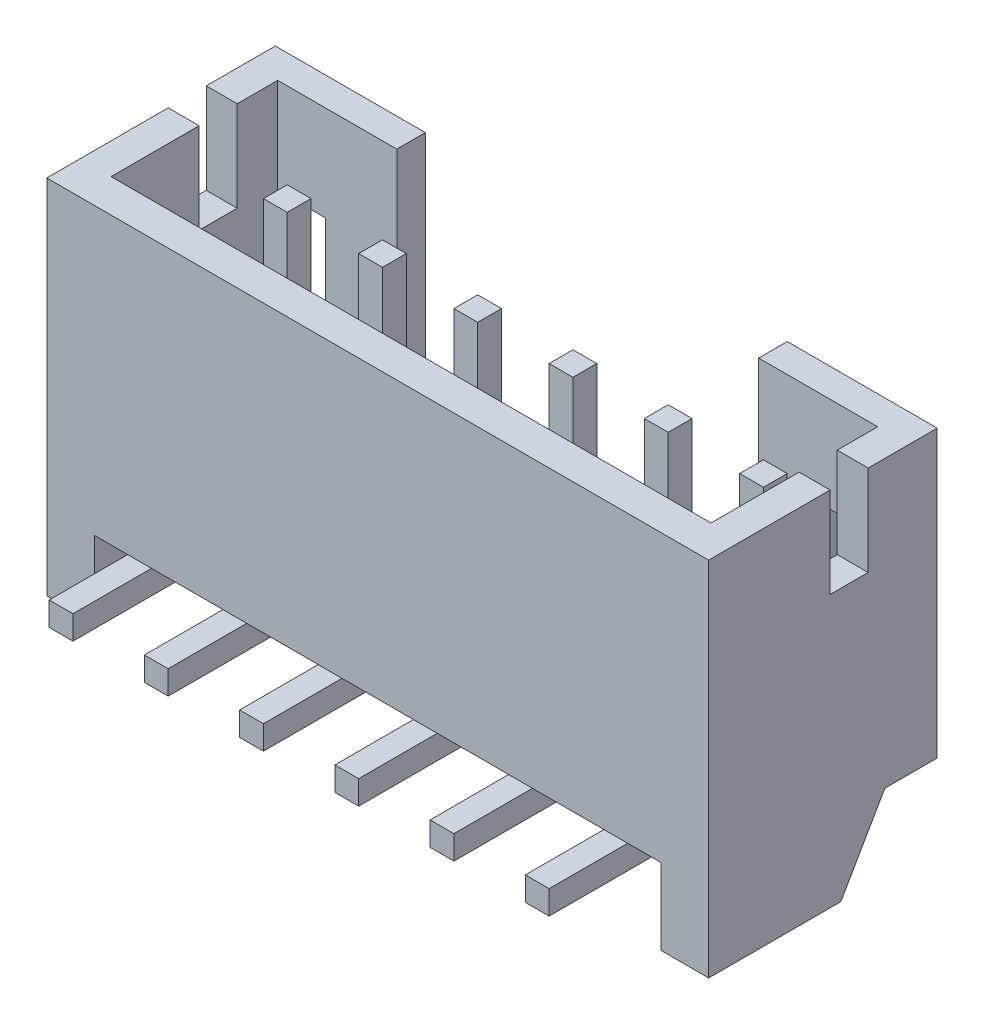
from build123d import *

# Parameters (mm, degrees)
SKETCH1_W           = 13.9
SKETCH1_H           = 4.8
BOSS_EXTRUDE1_DEPTH = 6
SKETCH2_W           = 12.6
SKETCH2_H           = 3.500000001
CUT_EXTRUDE1_DEPTH  = 4.25
SKETCH4_W           = 1
SKETCH4_H           = 4.8
BOSS_EXTRUDE2_DEPTH = 1.6
SKETCH5_W           = 0.8
SKETCH5_H           = 1.9
CUT_EXTRUDE3_DEPTH  = 16.328731193
SKETCH3_W           = 1
SKETCH3_H           = 4.000000001
SKETCH3_W_2         = 7.6
SKETCH3_H_2         = 4.25
CUT_EXTRUDE2_DEPTH  = 0.599999999
CUT_EXTRUDE4_START  = -6.3
CUT_EXTRUDE4_DEPTH  = 12.6
BOSS_EXTRUDE3_START = 5
BOSS_EXTRUDE3_DEPTH = 0.25
LPATTERN1_COUNT     = 6
LPATTERN1_PITCH     = 2


with BuildPart() as part:
    # Sketch1 → Boss-Extrude1 (new body)
    with BuildSketch(Plane(origin=(0, 0, 0), x_dir=(1, 0, 0), z_dir=(0, 1, 0))):
        Rectangle(SKETCH1_W, SKETCH1_H)
    extrude(amount=BOSS_EXTRUDE1_DEPTH)

    # Sketch2 → Cut-Extrude1 (cut)
    with BuildSketch(Plane(origin=(0, 6, 0), x_dir=(1, 0, 0), z_dir=(0, 1, 0))):
        with Locations((0, 0.05)):
            Rectangle(SKETCH2_W, SKETCH2_H)
    extrude(amount=-CUT_EXTRUDE1_DEPTH, mode=Mode.SUBTRACT)

    # Sketch4 → Boss-Extrude2 (add)
    with BuildSketch(Plane.XZ):
        with Locations((-6.45, 0)):
            Rectangle(SKETCH4_W, SKETCH4_H)
        with Locations((6.45, 0)):
            Rectangle(SKETCH4_W, SKETCH4_H)
    extrude(amount=BOSS_EXTRUDE2_DEPTH)

    # Sketch5 → Cut-Extrude3 (cut, through all)
    with BuildSketch(Plane.ZY.offset(6.95)):
        Polygon((-2.4, 0), (-1.3, 0), (-0.376239569, -1.6), (-2.4, -1.6), align=None)
        with Locations((-0.55, 5.05)):
            Rectangle(SKETCH5_W, SKETCH5_H)
    extrude(amount=-CUT_EXTRUDE3_DEPTH, mode=Mode.SUBTRACT)

    # Sketch3 → Cut-Extrude2 (cut)
    with BuildSketch(Plane(origin=(0, 0, -2.4), x_dir=(-1, 0, 0), z_dir=(0, 0, -1))):
        with Locations((-5.8, 2.000000001)):
            Rectangle(SKETCH3_W, SKETCH3_H)
        with Locations((0, 3.875)):
            Rectangle(SKETCH3_W_2, SKETCH3_H_2)
        with Locations((5.8, 2.000000001)):
            Rectangle(SKETCH3_W, SKETCH3_H)
    extrude(amount=-CUT_EXTRUDE2_DEPTH, mode=Mode.SUBTRACT)

    # Sketch6 → Cut-Extrude4 (cut)
    with BuildSketch(Plane(origin=(0, 0, 0), x_dir=(0, 0, -1), z_dir=(1, 0, 0)).offset(CUT_EXTRUDE4_START)):
        Polygon((0.15, 1.75), (-1.7, 1.75), (-1.7, 1.15), (-0.45, 1.15), align=None)
    extrude(amount=CUT_EXTRUDE4_DEPTH, mode=Mode.SUBTRACT)


with BuildPart() as body_2:
    # Sketch7 → Boss-Extrude3 (new, symmetric)
    with BuildSketch(Plane(origin=(0, 0, 0), x_dir=(0, 0, -1), z_dir=(1, 0, 0)).offset(BOSS_EXTRUDE3_START)):
        with BuildLine():
            Line((0.45, 5.05), (0.95, 5.05))
            Line((0.95, 5.05), (0.95, 0))
            ThreePointArc((0.95, 0), (0.803553391, -0.353553391), (0.45, -0.5))
            Line((0.45, -0.5), (-4.05, -0.5))
            Line((-4.05, -0.5), (-4.05, 0))
            Line((-4.05, 0), (0.45, 0))
            Line((0.45, 0), (0.45, 5.05))
        make_face()
    extrude(amount=BOSS_EXTRUDE3_DEPTH, both=True)


with BuildPart() as lpattern1_1:
    # LPattern1: pattern copy
    add(body_2.part.moved(Location(Vector(-1, 0, 0) * (1 * LPATTERN1_PITCH))))


with BuildPart() as lpattern1_2:
    # LPattern1: pattern copy
    add(body_2.part.moved(Location(Vector(-1, 0, 0) * (2 * LPATTERN1_PITCH))))


with BuildPart() as lpattern1_3:
    # LPattern1: pattern copy
    add(body_2.part.moved(Location(Vector(-1, 0, 0) * (3 * LPATTERN1_PITCH))))


with BuildPart() as lpattern1_4:
    # LPattern1: pattern copy
    add(body_2.part.moved(Location(Vector(-1, 0, 0) * (4 * LPATTERN1_PITCH))))


with BuildPart() as lpattern1_5:
    # LPattern1: pattern copy
    add(body_2.part.moved(Location(Vector(-1, 0, 0) * (5 * LPATTERN1_PITCH))))


with BuildPart() as lpattern1_4_1:
    add(lpattern1_4.part)

    # Combine1: union body 2, LPattern1_2, LPattern1_5, part, LPattern1_3, LPattern1_1
    add(body_2.part)
    add(lpattern1_2.part)
    add(lpattern1_5.part)
    add(part.part)
    add(lpattern1_3.part)
    add(lpattern1_1.part)


solid = lpattern1_4_1.part
